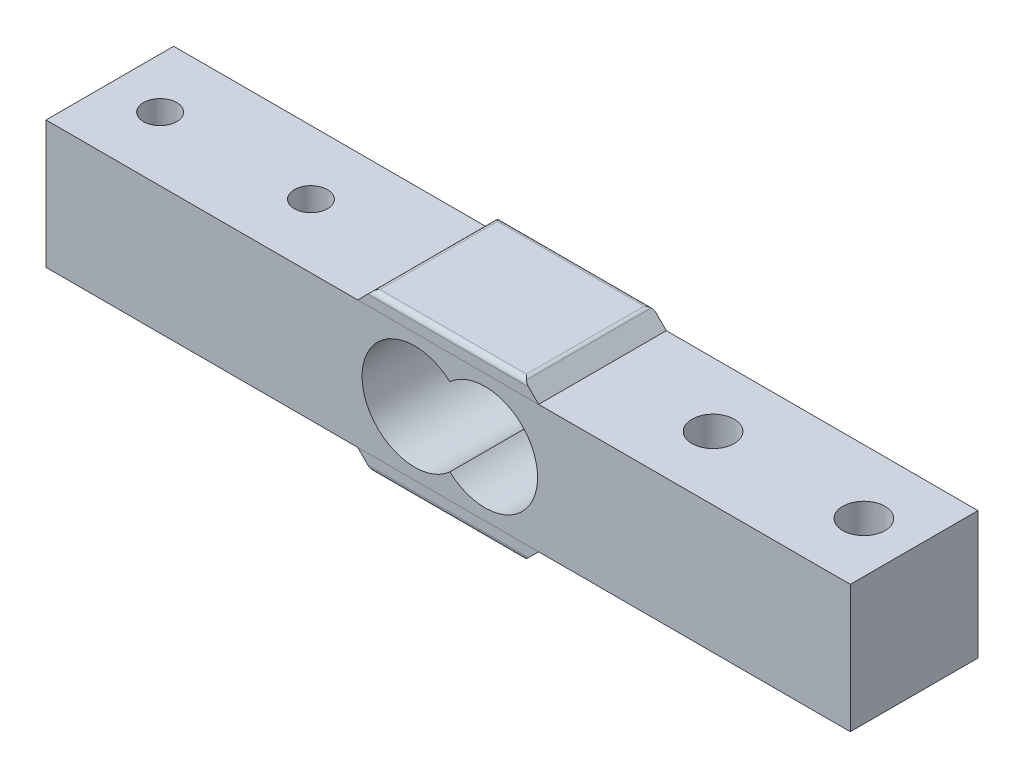
from build123d import *

# Parameters (mm, degrees)
CROQUIS1_W                = 80
CROQUIS1_H                = 12.7
SALIENTE_EXTRUIR1_DEPTH   = 6.35
CROQUIS2_R                = 5.23
CORTAR_EXTRUIR1_DEPTH     = 43.445406112
TALADRO_ROSCADO_M5X0_81_D = 4.2
TALADRO_ROSCADO_M4X0_71_D = 3.3
CORTAR_EXTRUIR2_DEPTH     = 0.01
SALIENTE_EXTRUIR2_DEPTH   = 12.7
REDONDEO1_R               = 0.5


with BuildPart() as part:
    # Croquis1 → Saliente-Extruir1 (new, symmetric)
    with BuildSketch(Plane.XY):
        Rectangle(CROQUIS1_W, CROQUIS1_H)
    extrude(amount=SALIENTE_EXTRUIR1_DEPTH, both=True)

    # Croquis2 → Cortar-Extruir1 (cut, through all)
    with BuildSketch(Plane.XY.offset(6.35)):
        with Locations((3.666407445, 0)):
            Circle(CROQUIS2_R)
        with Locations((-3.333592555, 0)):
            Circle(CROQUIS2_R)
    extrude(amount=-CORTAR_EXTRUIR1_DEPTH, mode=Mode.SUBTRACT)

    # Taladro roscado M5x0.81 (through all)
    with Locations(Plane(origin=(0, 6.35, 0), x_dir=(1, 0, 0), z_dir=(0, 1, 0))):
        with Locations((20, 0), (35, 0)):
            Hole(TALADRO_ROSCADO_M5X0_81_D / 2)

    # Taladro roscado M4x0.71 (through all)
    with Locations(Plane(origin=(0, 6.35, 0), x_dir=(1, 0, 0), z_dir=(0, 1, 0))):
        with Locations((-35, 0), (-20, 0)):
            Hole(TALADRO_ROSCADO_M4X0_71_D / 2)

    # Croquis7 → Cortar-Extruir2 (cut)
    # profile 1 of 3: a face of its own
    with BuildSketch(Plane.ZY.offset(40)):
        with BuildLine():
            Line((-1.518988284, 2.101749932), (-1.518988284, 1.742775573))
            Line((-1.518988284, 1.742775573), (-2.709493092, 1.742775573))
            Line((-2.709493092, 1.742775573), (-2.898094854, 0.822202656))
            add(Edge.make_bspline(
                [(-2.898094854, 0.822202656), (-2.86103898, 0.832432928), (-2.789249084, 0.852252461), (-2.683289223, 0.874258232), (-2.58269702, 0.887523676), (-2.517421649, 0.889334986), (-2.485835239, 0.89021147)],
                knots=[0, 0, 0, 0, 1.100273476, 2.13160584, 3.095893838, 4, 4, 4, 4], degree=3))
            add(Edge.make_bspline(
                [(-2.485835239, 0.89021147), (-2.446751499, 0.889365534), (-2.369903102, 0.887702213), (-2.257464155, 0.871730364), (-2.150131262, 0.846590449), (-2.048128892, 0.811469928), (-1.951268341, 0.766560194), (-1.86044078, 0.710460254), (-1.774282867, 0.644926923), (-1.694340273, 0.569581911), (-1.621815964, 0.486660294), (-1.558049975, 0.397502423), (-1.503887384, 0.302974761), (-1.46032663, 0.202174152), (-1.425542295, 0.096214999), (-1.4023903, -0.016017584), (-1.386973591, -0.133465704), (-1.385251205, -0.213770274), (-1.384372899, -0.254720421)],
                knots=[0, 0, 0, 0, 1.052922333, 2.070308379, 3.05430497, 4.020497103, 4.973039431, 5.925935799, 6.892292201, 7.88610001, 8.88166317, 9.857072816, 10.836096531, 11.812156883, 12.81219415, 13.836441305, 14.89672472, 16, 16, 16, 16], degree=3))
            add(Edge.make_bspline(
                [(-1.384372899, -0.254720421), (-1.385037975, -0.283242641), (-1.386359137, -0.339901629), (-1.393077725, -0.42404583), (-1.406013441, -0.506408663), (-1.423381165, -0.587001055), (-1.445923583, -0.665670427), (-1.473212637, -0.742641955), (-1.506608664, -0.817436561), (-1.54324004, -0.890761956), (-1.584486518, -0.960960464), (-1.630265025, -1.02660945), (-1.678630516, -1.088693732), (-1.730671902, -1.146547465), (-1.786872897, -1.199790483), (-1.846552864, -1.248738764), (-1.909235583, -1.294220094), (-1.975890825, -1.33438829), (-2.045033308, -1.371351246), (-2.117661525, -1.401674783), (-2.192122226, -1.428785311), (-2.269487101, -1.450394839), (-2.349580914, -1.467327393), (-2.432535689, -1.478827994), (-2.517916359, -1.487204431), (-2.575791372, -1.487728788), (-2.605025944, -1.487993658)],
                knots=[0, 0, 0, 0, 1.056347294, 2.098418968, 3.122841568, 4.141288669, 5.149314143, 6.15115421, 7.162517403, 8.180376062, 9.185164535, 10.17417709, 11.141909838, 12.097768115, 13.052685741, 14.0056014, 14.954263652, 15.917497458, 16.885230207, 17.854509472, 18.828990115, 19.81800267, 20.826176721, 21.857883937, 22.917946725, 24, 24, 24, 24], degree=3))
            add(Edge.make_bspline(
                [(-2.605025944, -1.487993658), (-2.639900125, -1.48730282), (-2.708510956, -1.485943678), (-2.809031523, -1.471725193), (-2.905746128, -1.451361276), (-2.99787623, -1.420725007), (-3.086247493, -1.382337712), (-3.169670211, -1.33382154), (-3.250275987, -1.278842437), (-3.324788024, -1.213962084), (-3.393944137, -1.143046402), (-3.455850646, -1.066088761), (-3.510984223, -0.984359318), (-3.55846197, -0.897461164), (-3.598959991, -0.805622633), (-3.630774979, -0.708499633), (-3.656453334, -0.606599629), (-3.667316755, -0.536446118), (-3.672834438, -0.500814171)],
                knots=[0, 0, 0, 0, 1.0467383, 2.05933395, 3.04377827, 4.011590433, 4.970194871, 5.932262533, 6.905835911, 7.896367577, 8.894135286, 9.877477877, 10.858688626, 11.851381753, 12.8477658, 13.868841284, 14.917554742, 16, 16, 16, 16], degree=3))
            Line((-3.672834438, -0.500814171), (-3.358731874, -0.500814171))
            add(Edge.make_bspline(
                [(-3.358731874, -0.500814171), (-3.351003316, -0.534190624), (-3.3361486, -0.598342018), (-3.303542851, -0.68847336), (-3.263676976, -0.768792583), (-3.216272627, -0.840362167), (-3.159722597, -0.902771164), (-3.095193168, -0.958388226), (-3.022845445, -1.008563355), (-2.942452215, -1.050386122), (-2.857639136, -1.086054876), (-2.768871926, -1.109806571), (-2.678567579, -1.126507464), (-2.617489209, -1.128179224), (-2.586796778, -1.129019299)],
                knots=[0, 0, 0, 0, 1.136247022, 2.183929868, 3.172523383, 4.106158343, 5.02341133, 5.958108904, 6.928429099, 7.938127109, 8.96079061, 9.975095812, 10.982467395, 12, 12, 12, 12], degree=3))
            add(Edge.make_bspline(
                [(-2.586796778, -1.129019299), (-2.556838333, -1.128198521), (-2.497849911, -1.126582403), (-2.411038524, -1.114143391), (-2.32722565, -1.09498582), (-2.247238293, -1.066315965), (-2.169676754, -1.031471246), (-2.096502983, -0.98675617), (-2.025600106, -0.935296152), (-1.959171973, -0.876339522), (-1.898332523, -0.811369827), (-1.844576402, -0.741892434), (-1.799799489, -0.667775587), (-1.76206538, -0.590302434), (-1.733412081, -0.508623877), (-1.7129711, -0.423122702), (-1.700968041, -0.333587722), (-1.699316861, -0.272518412), (-1.698475463, -0.241399107)],
                knots=[0, 0, 0, 0, 1.027316725, 2.022795036, 3.002884548, 3.971462791, 4.93288096, 5.914575861, 6.907176829, 7.935150275, 8.956128384, 9.956726525, 10.942570165, 11.921478529, 12.907843606, 13.90538589, 14.932640048, 16, 16, 16, 16], degree=3))
            add(Edge.make_bspline(
                [(-1.698475463, -0.241399107), (-1.699133943, -0.213323355), (-1.700422823, -0.158369066), (-1.710953393, -0.07796986), (-1.729270365, -0.001896818), (-1.754694245, 0.070217416), (-1.786973753, 0.138440859), (-1.826420065, 0.202843919), (-1.873773463, 0.262577752), (-1.927865352, 0.317670306), (-1.987123393, 0.368515181), (-2.052567135, 0.411859267), (-2.122827062, 0.448323185), (-2.197056662, 0.479791183), (-2.27702156, 0.502391929), (-2.361138193, 0.519359814), (-2.450314901, 0.529175177), (-2.511285589, 0.530537065), (-2.542626104, 0.531237111)],
                knots=[0, 0, 0, 0, 1.045622112, 2.046656509, 3.013763289, 3.955457236, 4.890082067, 5.820317437, 6.762574623, 7.722996705, 8.69280354, 9.665887285, 10.63943826, 11.638615906, 12.663482002, 13.728887084, 14.832589034, 16, 16, 16, 16], degree=3))
            add(Edge.make_bspline(
                [(-2.542626104, 0.531237111), (-2.569755033, 0.53065652), (-2.625769389, 0.529457746), (-2.711692215, 0.52063125), (-2.801983938, 0.506391955), (-2.896298434, 0.486805708), (-2.994918942, 0.461174631), (-3.097637343, 0.43046013), (-3.204669609, 0.393738132), (-3.276787334, 0.366005918), (-3.313860079, 0.351749932)],
                knots=[0, 0, 0, 0, 0.817624296, 1.688186739, 2.600797293, 3.572016777, 4.590301741, 5.671205678, 6.80286297, 8, 8, 8, 8], degree=3))
            Line((-3.313860079, 0.351749932), (-2.95488572, 2.101749932))
            Line((-2.95488572, 2.101749932), (-1.518988284, 2.101749932))
        make_face()
    # profile 2 of 3: a face of its own
    with BuildSketch(Plane.ZY.offset(40)):
        Polygon((-0.801039566, 2.191493521), (-0.486937002, 2.191493521), (-0.486937002, 0.116173008), (0.676925178, 1.159442239), (1.128447613, 1.159442239), (-0.221912963, -0.052096222), (1.263062998, -1.398250068), (0.812241684, -1.398250068), (-0.486937002, -0.219664331), (-0.486937002, -1.398250068), (-0.801039566, -1.398250068), align=None)
    # profile 3 of 3: a face of its own
    with BuildSketch(Plane.ZY.offset(40)):
        with BuildLine():
            Line((3.865627101, 1.159442239), (4.179729665, 1.159442239))
            Line((4.179729665, 1.159442239), (4.179729665, -0.870305357))
            add(Edge.make_bspline(
                [(4.179729665, -0.870305357), (4.179452622, -0.913542952), (4.178917863, -0.997001924), (4.175066892, -1.117680204), (4.166946215, -1.229146289), (4.157737533, -1.331908548), (4.144490817, -1.425490658), (4.12831445, -1.510171863), (4.110078771, -1.586033425), (4.094058553, -1.632758266), (4.086480466, -1.654860645)],
                knots=[0, 0, 0, 0, 1.307562039, 2.523909702, 3.650326591, 4.686913197, 5.643429486, 6.506965704, 7.293745905, 8, 8, 8, 8], degree=3))
            add(Edge.make_bspline(
                [(4.086480466, -1.654860645), (4.075291227, -1.683590567), (4.053247301, -1.740191404), (4.011961667, -1.820425725), (3.965727764, -1.895972115), (3.912921013, -1.966409566), (3.853780209, -2.031384478), (3.789698717, -2.092308478), (3.719428526, -2.147892645), (3.643009813, -2.197177942), (3.56220418, -2.241564997), (3.477058078, -2.280011564), (3.38805164, -2.313498407), (3.294348748, -2.338581203), (3.197418514, -2.360315924), (3.096121083, -2.37446061), (2.991048286, -2.384087668), (2.919602906, -2.384977901), (2.883355466, -2.385429556)],
                knots=[0, 0, 0, 0, 0.981931301, 1.934503488, 2.87077864, 3.801706999, 4.735015492, 5.667491629, 6.616593066, 7.585388521, 8.561939025, 9.551802639, 10.560317337, 11.588439944, 12.640189604, 13.723962949, 14.845264515, 16, 16, 16, 16], degree=3))
            add(Edge.make_bspline(
                [(2.883355466, -2.385429556), (2.830470731, -2.38457307), (2.727172636, -2.382900123), (2.576567644, -2.363409208), (2.433532924, -2.335854835), (2.299958467, -2.294149407), (2.17668837, -2.243112417), (2.064564495, -2.184517464), (1.964593387, -2.117328156), (1.874469714, -2.040827555), (1.793128124, -1.949863873), (1.716600834, -1.842665029), (1.642939892, -1.71759814), (1.599771254, -1.625805427), (1.577165562, -1.577737248)],
                knots=[0, 0, 0, 0, 1.157897085, 2.2616841, 3.32207898, 4.345638746, 5.321241055, 6.241986252, 7.112515963, 7.955008012, 8.825025602, 9.77857164, 10.836726669, 12, 12, 12, 12], degree=3))
            Line((1.577165562, -1.577737248), (1.891268126, -1.577737248))
            add(Edge.make_bspline(
                [(1.891268126, -1.577737248), (1.916530336, -1.617843124), (1.965914844, -1.696245172), (2.058263325, -1.797758328), (2.159469651, -1.884511693), (2.272949335, -1.954422467), (2.39917455, -2.007132258), (2.538221236, -2.044707555), (2.691220858, -2.067203822), (2.797739072, -2.069915116), (2.853207229, -2.071326992)],
                knots=[0, 0, 0, 0, 0.997731894, 1.950442991, 2.880492273, 3.800895997, 4.748200782, 5.754801363, 6.83083817, 8, 8, 8, 8], degree=3))
            add(Edge.make_bspline(
                [(2.853207229, -2.071326992), (2.907974119, -2.069896843), (3.013559202, -2.067139659), (3.165390371, -2.044697515), (3.303985309, -2.007124081), (3.42854551, -1.954515695), (3.537601278, -1.890065288), (3.631613269, -1.818065214), (3.707757946, -1.736884211), (3.758970912, -1.662102405), (3.79080553, -1.595478275), (3.811077767, -1.538125679), (3.827551736, -1.473272801), (3.841331574, -1.401137065), (3.852702487, -1.321615408), (3.859905369, -1.234526005), (3.865111181, -1.140066783), (3.865451151, -1.074573644), (3.865627101, -1.040677953)],
                knots=[0, 0, 0, 0, 1.570740765, 3.028230971, 4.391408896, 5.680370741, 6.894727393, 8.017376726, 9.065722033, 10.075533815, 10.603371122, 11.180248986, 11.817768598, 12.521299649, 13.286540596, 14.121245857, 15.027658897, 16, 16, 16, 16], degree=3))
            Line((3.865627101, -1.040677953), (3.865627101, -0.908165934))
            add(Edge.make_bspline(
                [(3.865627101, -0.908165934), (3.833745983, -0.946107736), (3.770544528, -1.021323956), (3.6613972, -1.119885592), (3.542180285, -1.204771723), (3.413096742, -1.274390357), (3.2773085, -1.330071782), (3.13628627, -1.369014743), (2.991294215, -1.394174643), (2.893042065, -1.396881959), (2.843391524, -1.398250068)],
                knots=[0, 0, 0, 0, 1.012485704, 2.007162095, 2.997754123, 3.998611389, 4.999708251, 5.992315798, 6.98544096, 8, 8, 8, 8], degree=3))
            add(Edge.make_bspline(
                [(2.843391524, -1.398250068), (2.814155254, -1.397735042), (2.756028697, -1.396711084), (2.66967395, -1.387752306), (2.584593511, -1.374753564), (2.500985808, -1.355672125), (2.418730195, -1.331180399), (2.337962602, -1.30056366), (2.258029076, -1.265948542), (2.180382578, -1.225175738), (2.105796447, -1.179813431), (2.034833262, -1.130674541), (1.967864723, -1.078016252), (1.905528234, -1.021319313), (1.847905562, -0.96066578), (1.794221694, -0.896702227), (1.745364347, -0.828535485), (1.700330958, -0.757408528), (1.661273407, -0.682847604), (1.626989036, -0.606469509), (1.597179631, -0.528437554), (1.573414229, -0.448490492), (1.555263116, -0.366678723), (1.541752889, -0.283136274), (1.534089957, -0.197605886), (1.532895033, -0.139984537), (1.532293767, -0.110990453)],
                knots=[0, 0, 0, 0, 1.028754217, 2.045334182, 3.052854819, 4.056607503, 5.061168794, 6.071104265, 7.095078842, 8.125279047, 9.155117945, 10.165957491, 11.161587969, 12.151493252, 13.128948131, 14.104219989, 15.088194871, 16.07871515, 17.064853787, 18.047899887, 19.02414258, 20.002704429, 20.980574569, 21.971845993, 22.979467364, 24, 24, 24, 24], degree=3))
            add(Edge.make_bspline(
                [(1.532293767, -0.110990453), (1.532812934, -0.081987357), (1.533849255, -0.024093498), (1.542800235, 0.061785887), (1.555568424, 0.146515322), (1.575776193, 0.229221464), (1.600098716, 0.310846216), (1.630222288, 0.390786672), (1.666441048, 0.469067181), (1.707450797, 0.545745713), (1.75353489, 0.619793328), (1.804067371, 0.690119974), (1.859109245, 0.756208146), (1.917901161, 0.818724567), (1.981160978, 0.877066061), (2.04885597, 0.931091025), (2.12031885, 0.981705052), (2.1957711, 1.027816389), (2.274048489, 1.068598635), (2.353162306, 1.105811232), (2.434160542, 1.135345352), (2.515533081, 1.161368451), (2.598712996, 1.179803646), (2.682680389, 1.194025888), (2.767722727, 1.202690609), (2.824675622, 1.203772194), (2.853207229, 1.204314034)],
                knots=[0, 0, 0, 0, 1.008818848, 2.013730394, 3.001654427, 3.987803273, 4.973046549, 5.963777569, 6.957074694, 7.972068341, 8.987420212, 9.989399531, 10.982630087, 11.977756091, 12.973280677, 13.973972381, 14.989194003, 16.018387222, 17.047741039, 18.059210846, 19.057554164, 20.045176975, 21.029480261, 22.018708529, 23.007435371, 24, 24, 24, 24], degree=3))
            add(Edge.make_bspline(
                [(2.853207229, 1.204314034), (2.900258168, 1.202957361), (2.993169315, 1.200278348), (3.129900318, 1.179257203), (3.261842558, 1.145743189), (3.389740573, 1.097727559), (3.514636224, 1.03217752), (3.63611788, 0.945834572), (3.754537014, 0.837924233), (3.827614844, 0.755171368), (3.865627101, 0.712126534)],
                knots=[0, 0, 0, 0, 0.96728863, 1.910097829, 2.838038873, 3.762875196, 4.71315279, 5.730631239, 6.819562287, 8, 8, 8, 8], degree=3))
            Line((3.865627101, 0.712126534), (3.865627101, 1.159442239))
        make_face()
        with BuildLine():
            add(Edge.make_bspline(
                [(2.878447613, 0.89021147), (2.83251691, 0.888650404), (2.741583855, 0.885559826), (2.608295513, 0.859175113), (2.479618579, 0.817829213), (2.358013151, 0.758686597), (2.244106041, 0.686592359), (2.143031221, 0.599252072), (2.054626305, 0.499505875), (1.979843366, 0.388255628), (1.920312, 0.268233352), (1.87816858, 0.141722618), (1.850918557, 0.010767625), (1.847910905, -0.078604978), (1.846396331, -0.123610645)],
                knots=[0, 0, 0, 0, 1.026226791, 2.031711442, 3.026614839, 4.04107745, 5.047145931, 6.032893242, 7.017642609, 8.019221815, 9.021877557, 10.003543541, 10.994637589, 12, 12, 12, 12], degree=3))
            add(Edge.make_bspline(
                [(1.846396331, -0.123610645), (1.847122088, -0.157543918), (1.84854944, -0.224280742), (1.862273017, -0.322218637), (1.884453983, -0.41549895), (1.915891189, -0.504127325), (1.954843884, -0.58861212), (2.003836255, -0.668371354), (2.061487226, -0.74347606), (2.127345564, -0.813370742), (2.199921946, -0.877031711), (2.278641146, -0.932969751), (2.363396395, -0.978720472), (2.452103206, -1.01826131), (2.546913961, -1.047140378), (2.646463048, -1.069179157), (2.751454744, -1.081787914), (2.823026483, -1.083350712), (2.859517325, -1.084147504)],
                knots=[0, 0, 0, 0, 1.039728707, 2.044842319, 3.024901384, 3.974314358, 4.923051295, 5.871625912, 6.837440708, 7.820715446, 8.810779094, 9.792721783, 10.773906224, 11.758876063, 12.764959493, 13.806266761, 14.881525401, 16, 16, 16, 16], degree=3))
            add(Edge.make_bspline(
                [(2.859517325, -1.084147504), (2.896481083, -1.083379895), (2.968763321, -1.081878844), (3.074334257, -1.068975345), (3.174366997, -1.048153369), (3.26876982, -1.018590344), (3.357899161, -0.980868593), (3.440753775, -0.933131976), (3.519110224, -0.878767544), (3.590466633, -0.815355529), (3.654990799, -0.745470534), (3.711221566, -0.669425639), (3.759136015, -0.58836512), (3.798813684, -0.502298115), (3.829104889, -0.410555762), (3.849423794, -0.313367406), (3.863630539, -0.211198667), (3.864951463, -0.141190051), (3.865627101, -0.105381479)],
                knots=[0, 0, 0, 0, 1.121943988, 2.193949579, 3.223793937, 4.220241907, 5.192961521, 6.155822191, 7.11847367, 8.083710714, 9.04790392, 10.001595906, 10.949595423, 11.902125208, 12.873731292, 13.87582262, 14.913508608, 16, 16, 16, 16], degree=3))
            add(Edge.make_bspline(
                [(3.865627101, -0.105381479), (3.864287533, -0.058763625), (3.861670487, 0.03231128), (3.836973329, 0.165018048), (3.797153119, 0.289786722), (3.741306367, 0.406222698), (3.671324358, 0.513092248), (3.587033509, 0.608416092), (3.489887479, 0.692316949), (3.380165379, 0.762215142), (3.262117933, 0.818680577), (3.138596737, 0.861042349), (3.009785173, 0.885036664), (2.922478764, 0.888476607), (2.878447613, 0.89021147)],
                knots=[0, 0, 0, 0, 1.070913519, 2.092188694, 3.091357305, 4.074328408, 5.051968682, 6.018948707, 6.99050112, 7.9935919, 9.000589572, 9.992915277, 10.987769056, 12, 12, 12, 12], degree=3))
        make_face(mode=Mode.SUBTRACT)
    extrude(amount=-CORTAR_EXTRUIR2_DEPTH, mode=Mode.SUBTRACT)


with BuildPart() as body_2:
    # Croquis8 → Saliente-Extruir2 (new body)
    with BuildSketch(Plane.XY.offset(6.35)):
        Polygon((-9, 6.35), (-7.5, 7.85), (7.5, 7.85), (9, 6.35), align=None)
    extrude(amount=-SALIENTE_EXTRUIR2_DEPTH)

    # Redondeo1
    redondeo1_edges = [body_2.edges().sort_by_distance(p)[0] for p in [
        (7.5, 7.85, 0),
        (-7.5, 7.85, 0),
        (0, 7.85, -6.35),
        (0, 7.85, 6.35),
    ]]
    fillet(redondeo1_edges, radius=REDONDEO1_R)


with BuildPart() as body_3:
    # Simetría2: mirrored copy
    add(body_2.part.mirror(Plane.ZX))


solid = Compound([part.part, body_2.part, body_3.part])
